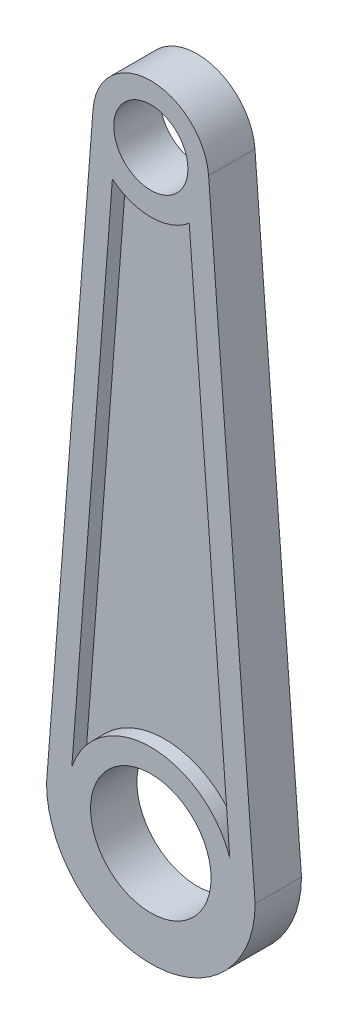
from build123d import *

# Parameters (mm, degrees)
SKETCH1_R           = 12.5
SKETCH1_R_2         = 8
SKETCH1_R_3         = 13
BOSS_EXTRUDE1_DEPTH = 5
CUT_EXTRUDE1_DEPTH  = 3


with BuildPart() as part:
    # Sketch1 → Boss-Extrude1 (new, symmetric)
    # profile 1 of 3: a face of its own
    with BuildSketch(Plane.XY):
        with BuildLine():
            Line((-12.463466587, 130.955210764), (-22.23722085, 3.428703671))
            ThreePointArc((-22.23722085, 3.428703671), (-5.852e-06, 22.5), (22.237219067, 3.428715237))
            Line((22.237219067, 3.428715237), (12.463432081, 130.955214005))
            ThreePointArc((12.463432081, 130.955214005), (12.490841831, 130.477956524), (12.499982871, 130))
            ThreePointArc((12.499982871, 130), (-0.477972029, 117.509140978), (-12.463466587, 130.955210764))
        make_face()
    # profile 2 of 3: a face of its own
    with BuildSketch(Plane.XY):
        with Locations((-1.7129e-05, 130)):
            Circle(SKETCH1_R)
        with Locations((-1.7129e-05, 130)):
            Circle(SKETCH1_R_2, mode=Mode.SUBTRACT)
    # profile 3 of 3: a face of its own
    with BuildSketch(Plane.XY):
        with BuildLine():
            Line((-22.23722085, 3.428703671), (-22.5, 0))
            ThreePointArc((-22.5, 0), (0, -22.5), (22.5, 0))
            Line((22.5, 0), (22.237219067, 3.428715237))
            ThreePointArc((22.237219067, 3.428715237), (-5.852e-06, 22.5), (-22.23722085, 3.428703671))
        make_face()
        Circle(SKETCH1_R_3, mode=Mode.SUBTRACT)
    extrude(amount=BOSS_EXTRUDE1_DEPTH, both=True)

    # Sketch2 → Cut-Extrude1 (cut)
    with BuildSketch(Plane.XY.offset(5)):
        with BuildLine():
            Line((17.041069078, 5.796720166), (8.289478443, 119.985796928))
            ThreePointArc((8.289478443, 119.985796928), (-1.5438e-05, 117), (-8.289510096, 119.985794772))
            Line((-8.289510096, 119.985794772), (-17.041071164, 5.796714033))
            ThreePointArc((-17.041071164, 5.796714033), (-3.239e-06, 18), (17.041069078, 5.796720166))
        make_face()
    cut_extrude1 = extrude(amount=-CUT_EXTRUDE1_DEPTH, mode=Mode.SUBTRACT)

    # Mirror1: Cut-Extrude1 across plane
    add(cut_extrude1.mirror(Plane.XY), mode=Mode.SUBTRACT)


solid = part.part
